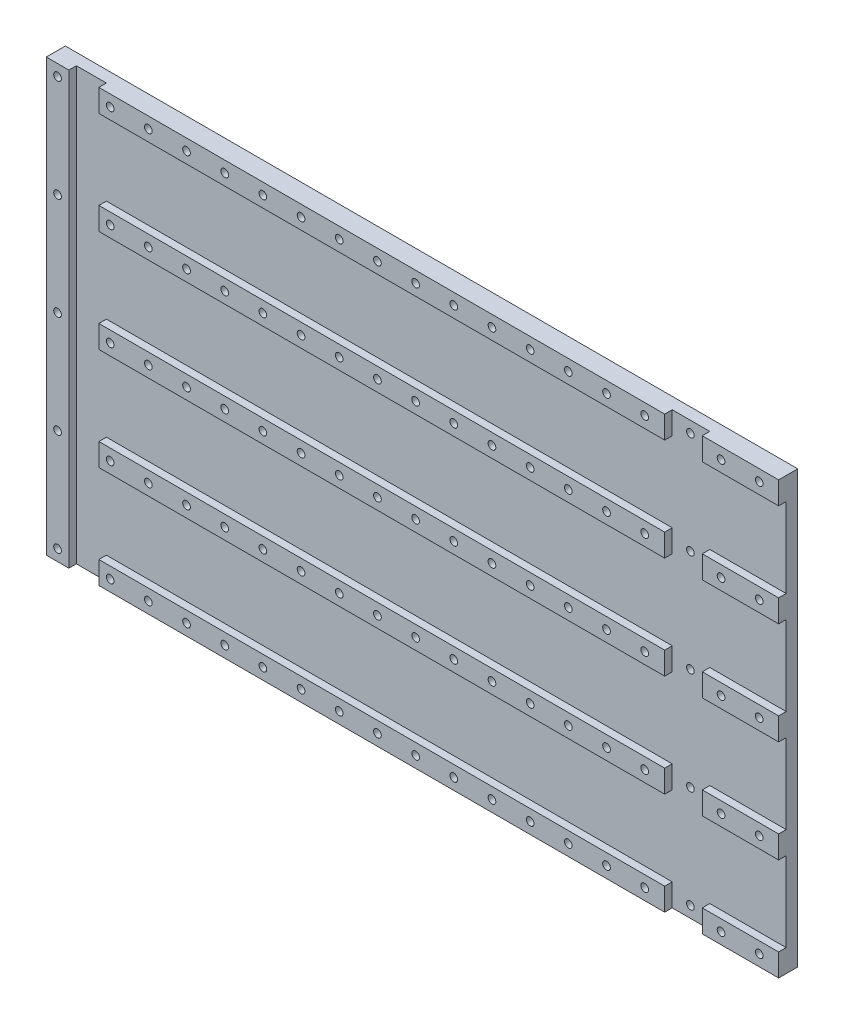
from build123d import *

# Parameters (mm, degrees)
SKETCH2_W          = 487.2
SKETCH2_H          = 287
EXTRUDE1_DEPTH     = 12.7
SKETCH3_W          = 376.4
SKETCH3_H          = 15
CUT_EXTRUDE1_DEPTH = 5
SKETCH4_R          = 2.5527
CUT_EXTRUDE2_DEPTH = 566.591840464
LPATTERN1_COUNT    = 18
LPATTERN1_PITCH    = 25.4
SKETCH6_R          = 2.5527
CUT_EXTRUDE3_DEPTH = 566.591840464


with BuildPart() as part:
    # Sketch2 → Extrude1 (new body)
    with BuildSketch(Plane.XY):
        with Locations((243.6, 143.5)):
            Rectangle(SKETCH2_W, SKETCH2_H)
    extrude(amount=EXTRUDE1_DEPTH)

    # Sketch3 → Cut-Extrude1 (cut)
    with BuildSketch(Plane.XY.offset(12.7)):
        Polygon((35, 272), (411.4, 272), (411.4, 287), (436.4, 287), (436.4, 272), (487.2, 272), (487.2, 219), (436.4, 219), (436.4, 204), (487.2, 204), (487.2, 151), (436.4, 151), (436.4, 136), (487.2, 136), (487.2, 83), (436.4, 83), (436.4, 68), (487.2, 68), (487.2, 15), (436.4, 15), (436.4, 0), (411.4, 0), (411.4, 15), (35, 15), (35, 0), (15, 0), (15, 287), (35, 287), align=None)
        with Locations((223.2, 211.5)):
            Rectangle(SKETCH3_W, SKETCH3_H, mode=Mode.SUBTRACT)
        with Locations((223.2, 143.5)):
            Rectangle(SKETCH3_W, SKETCH3_H, mode=Mode.SUBTRACT)
        with Locations((223.2, 75.5)):
            Rectangle(SKETCH3_W, SKETCH3_H, mode=Mode.SUBTRACT)
    extrude(amount=-CUT_EXTRUDE1_DEPTH, mode=Mode.SUBTRACT)

    # Sketch4 → Cut-Extrude2 (cut, through all)
    with BuildSketch(Plane.XY.offset(12.7)):
        with Locations((42.5, 279.5)):
            Circle(SKETCH4_R)
        with Locations((42.5, 211.5)):
            Circle(SKETCH4_R)
        with Locations((42.5, 143.5)):
            Circle(SKETCH4_R)
        with Locations((42.5, 75.5)):
            Circle(SKETCH4_R)
        with Locations((42.5, 7.5)):
            Circle(SKETCH4_R)
    cut_extrude2 = extrude(amount=-CUT_EXTRUDE2_DEPTH, mode=Mode.SUBTRACT)

    # LPattern1: Cut-Extrude2 ×18
    with Locations(*[(i * LPATTERN1_PITCH, 0, 0) for i in range(1, LPATTERN1_COUNT)]):
        add(cut_extrude2, mode=Mode.SUBTRACT)

    # Sketch6 → Cut-Extrude3 (cut, through all)
    with BuildSketch(Plane.XY.offset(12.7)):
        with Locations((7.5, 279.5)):
            Circle(SKETCH6_R)
        with Locations((7.5, 211.5)):
            Circle(SKETCH6_R)
        with Locations((7.5, 143.5)):
            Circle(SKETCH6_R)
        with Locations((7.5, 75.5)):
            Circle(SKETCH6_R)
        with Locations((7.5, 7.5)):
            Circle(SKETCH6_R)
    extrude(amount=-CUT_EXTRUDE3_DEPTH, mode=Mode.SUBTRACT)


solid = part.part
